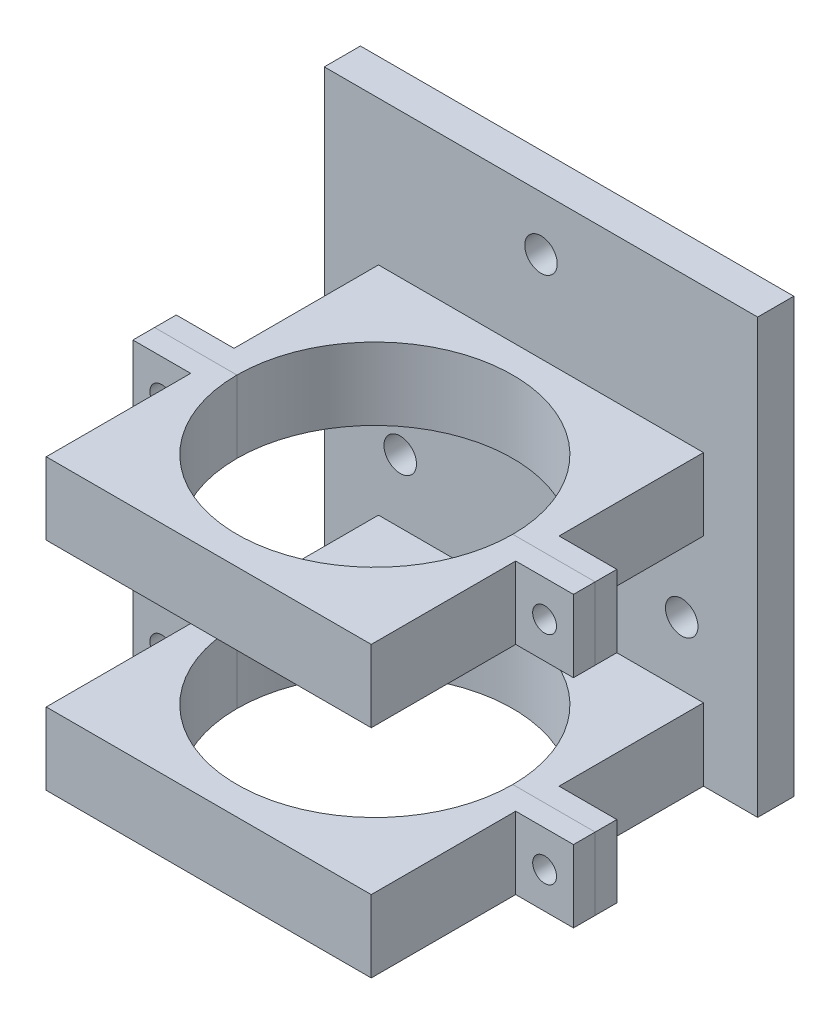
from build123d import *

# Parameters (mm, degrees)
SKETCH_1_W          = 60
SKETCH_1_H          = 60
EXTRUDE_1_DEPTH     = 5
SKETCH_2_R          = 2.25
CUT_EXTRUDE_1_DEPTH = 43.720018727
EXTRUDE_2_DEPTH     = 10
EXTRUDE_3_DEPTH     = 10
SKETCH_5_R          = 19.1
CUT_EXTRUDE_2_DEPTH = 72.632743909
CUT_EXTRUDE_3_REACH = 54.832
SKETCH_7_R          = 1.65


with BuildPart() as part:
    # ｽｹｯﾁ1 → ﾎﾞｽ - 押し出し1 (new body)
    with BuildSketch(Plane.XY):
        Rectangle(SKETCH_1_W, SKETCH_1_H)
    extrude(amount=EXTRUDE_1_DEPTH)

    # ｽｹｯﾁ2 → ｶｯﾄ - 押し出し1 (cut, through all)
    with BuildSketch(Plane.XY.offset(5)):
        with Locations((0, 22.5)):
            Circle(SKETCH_2_R)
        with Locations((19.485571585, -11.25)):
            Circle(SKETCH_2_R)
        with Locations((-19.485571585, -11.25)):
            Circle(SKETCH_2_R)
    extrude(amount=-CUT_EXTRUDE_1_DEPTH, mode=Mode.SUBTRACT)

    # ｽｹｯﾁ3 → ﾎﾞｽ - 押し出し2 (add)
    with BuildSketch(Plane.XZ.offset(30)):
        Polygon((22.5, 5), (-22.5, 5), (-22.5, 25), (-30.5, 25), (-30.5, 31), (-22.5, 31), (-22.5, 51), (22.5, 51), (22.5, 31), (30.5, 31), (30.5, 25), (22.5, 25), align=None)
    extrude(amount=-EXTRUDE_2_DEPTH)

    # ｽｹｯﾁ4 → ﾎﾞｽ - 押し出し3 (add)
    with BuildSketch(Plane(origin=(0, 0, 0), x_dir=(1, 0, 0), z_dir=(0, 1, 0))):
        Polygon((-22.5, -51), (22.5, -51), (22.5, -31), (30.5, -31), (30.5, -25), (22.5, -25), (22.5, -5), (-22.5, -5), (-22.5, -25), (-30.5, -25), (-30.5, -31), (-22.5, -31), align=None)
    extrude(amount=EXTRUDE_3_DEPTH)

    # ｽｹｯﾁ5 → ｶｯﾄ - 押し出し2 (cut, through all)
    with BuildSketch(Plane(origin=(0, 10, 0), x_dir=(1, 0, 0), z_dir=(0, 1, 0))):
        with Locations(Location((0, -28, 0), (0, 0, 270))):
            Circle(SKETCH_5_R)
    extrude(amount=-CUT_EXTRUDE_2_DEPTH, mode=Mode.SUBTRACT)

    # ｽｹｯﾁ7 → ｶｯﾄ - 押し出し3 (cut, up to next)
    with BuildSketch(Plane.XY.offset(31), mode=Mode.PRIVATE) as cut_extrude_3_sk1:
        with Locations((-26.5, 5)):
            Circle(SKETCH_7_R)
    cut_extrude_3_tool1 = extrude(cut_extrude_3_sk1.sketch, amount=-CUT_EXTRUDE_3_REACH, mode=Mode.PRIVATE) & part.part
    # ｽｹｯﾁ7 → ｶｯﾄ - 押し出し3 (cut, up to next)
    with BuildSketch(Plane.XY.offset(31), mode=Mode.PRIVATE) as cut_extrude_3_sk2:
        with Locations((26.5, 5)):
            Circle(SKETCH_7_R)
    cut_extrude_3_tool2 = extrude(cut_extrude_3_sk2.sketch, amount=-CUT_EXTRUDE_3_REACH, mode=Mode.PRIVATE) & part.part
    # ｽｹｯﾁ7 → ｶｯﾄ - 押し出し3 (cut, up to next)
    with BuildSketch(Plane.XY.offset(31), mode=Mode.PRIVATE) as cut_extrude_3_sk3:
        with Locations((26.5, -25)):
            Circle(SKETCH_7_R)
    cut_extrude_3_tool3 = extrude(cut_extrude_3_sk3.sketch, amount=-CUT_EXTRUDE_3_REACH, mode=Mode.PRIVATE) & part.part
    # ｽｹｯﾁ7 → ｶｯﾄ - 押し出し3 (cut, up to next)
    with BuildSketch(Plane.XY.offset(31), mode=Mode.PRIVATE) as cut_extrude_3_sk4:
        with Locations((-26.5, -25)):
            Circle(SKETCH_7_R)
    cut_extrude_3_tool4 = extrude(cut_extrude_3_sk4.sketch, amount=-CUT_EXTRUDE_3_REACH, mode=Mode.PRIVATE) & part.part
    add(cut_extrude_3_tool1.solids().sort_by_distance((-26.5, 5, 31))[0], mode=Mode.SUBTRACT)
    add(cut_extrude_3_tool2.solids().sort_by_distance((26.5, 5, 31))[0], mode=Mode.SUBTRACT)
    add(cut_extrude_3_tool3.solids().sort_by_distance((26.5, -25, 31))[0], mode=Mode.SUBTRACT)
    add(cut_extrude_3_tool4.solids().sort_by_distance((-26.5, -25, 31))[0], mode=Mode.SUBTRACT)


with BuildPart() as body_2:
    # Split Bodies 1: the piece on the far side of the plane
    add(part.part)
    split(bisect_by=Plane.XY.offset(28), keep=Keep.BOTTOM)


with BuildPart() as part_1:
    add(part.part)

    # Split Bodies 1
    split(bisect_by=Plane.XY.offset(28), keep=Keep.TOP)


solid = Compound([body_2.part, part_1.part])
